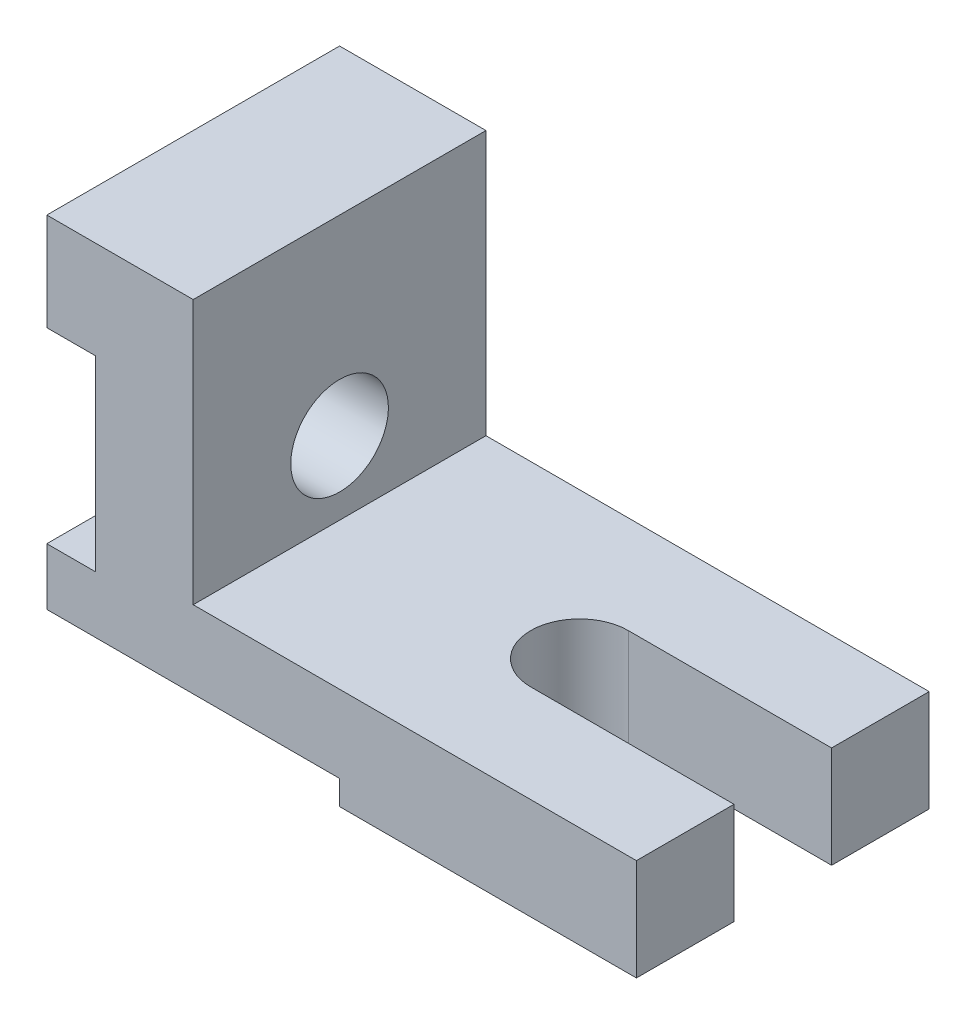
from build123d import *

# Parameters (mm, degrees)
BOSS_EXTRUDE1_DEPTH    = 72
SKETCH2_W              = 72
SKETCH2_H              = 6
CUT_EXTRUDE1_DEPTH     = 50
SKETCH3_R              = 30
CUT_EXTRUDE2_DEPTH     = 12
F_20_0MM_DOWEL_HOLE1_D = 24
CUT_EXTRUDE3_REACH     = 176.453


with BuildPart() as part:
    # Sketch1 → Boss-Extrude1 (new body)
    with BuildSketch(Plane.XY):
        Polygon((0, 66), (12, 66), (12, 20), (0, 20), (0, 0), (29.646636928, 0), (145, 0), (145, 25), (36, 25), (36, 90), (0, 90), align=None)
    extrude(amount=BOSS_EXTRUDE1_DEPTH)

    # Sketch2 → Cut-Extrude1 (cut)
    with BuildSketch(Plane.XY.offset(72)):
        with Locations((36, 3)):
            Rectangle(SKETCH2_W, SKETCH2_H)
    extrude(amount=-CUT_EXTRUDE1_DEPTH, mode=Mode.SUBTRACT)

    # Sketch3 → Cut-Extrude2 (cut)
    with BuildSketch(Plane.ZY.offset(-12)):
        with Locations((36, 43)):
            Circle(SKETCH3_R)
    extrude(amount=CUT_EXTRUDE2_DEPTH, mode=Mode.SUBTRACT)

    # Ø20.0mm Dowel Hole1 (through all)
    with Locations(Plane.ZY.offset(-12)):
        with Locations((36, 43)):
            Hole(F_20_0MM_DOWEL_HOLE1_D / 2)

    # Sketch8 → Cut-Extrude3 (cut, up to next)
    with BuildSketch(Plane(origin=(0, 25, 0), x_dir=(1, 0, 0), z_dir=(0, 1, 0)), mode=Mode.PRIVATE) as cut_extrude3_sk1:
        with BuildLine():
            Line((195, -48), (95, -48))
            ThreePointArc((95, -48), (83, -36), (95, -24))
            Line((95, -24), (195, -24))
            ThreePointArc((195, -24), (207, -36), (195, -48))
        make_face()
    cut_extrude3_tool1 = extrude(cut_extrude3_sk1.sketch, amount=-CUT_EXTRUDE3_REACH, mode=Mode.PRIVATE) & part.part
    add(cut_extrude3_tool1.solids().sort_by_distance((145, 25, 36))[0], mode=Mode.SUBTRACT)


solid = part.part
